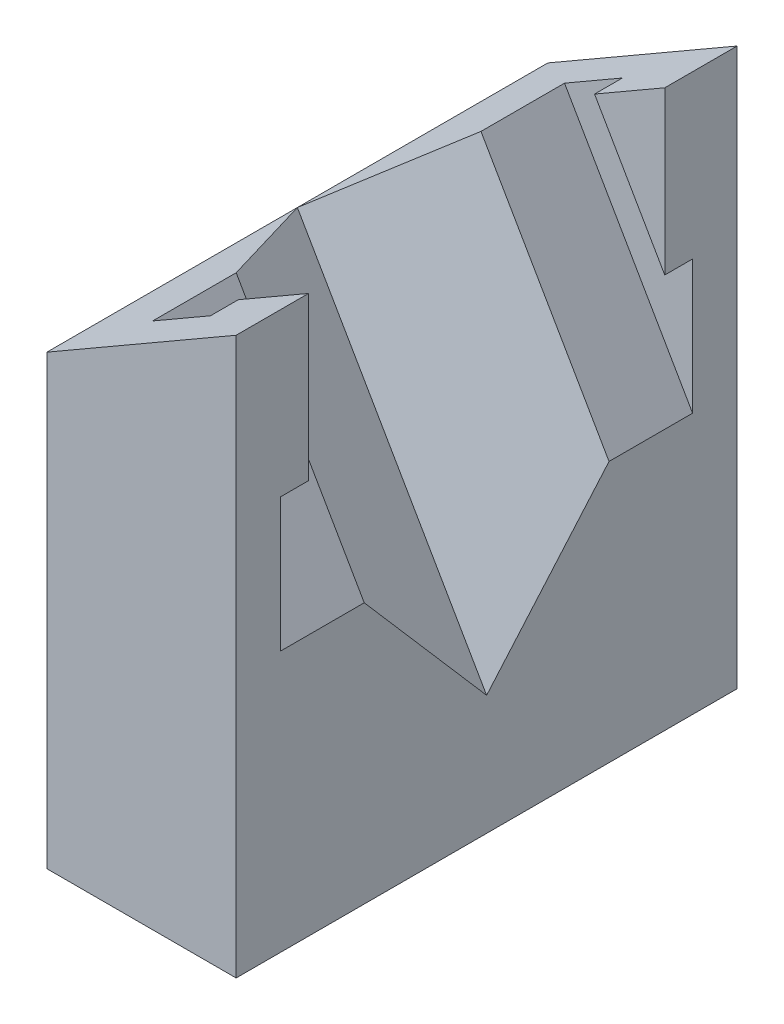
from build123d import *

# Parameters (mm, degrees)
SKETCH1_W           = 17
SKETCH1_H           = 45
BOSS_EXTRUDE1_DEPTH = 50
CUT_EXTRUDE1_DEPTH  = 68.803023531
CUT_EXTRUDE3_DEPTH  = 50.350151975


with BuildPart() as part:
    # Sketch1 → Boss-Extrude1 (new body)
    with BuildSketch(Plane(origin=(0, 0, 0), x_dir=(1, 0, 0), z_dir=(0, 1, 0))):
        Rectangle(SKETCH1_W, SKETCH1_H)
    extrude(amount=BOSS_EXTRUDE1_DEPTH)

    # Sketch2 → Cut-Extrude1 (cut, through all)
    with BuildSketch(Plane.XY.offset(22.5)):
        Polygon((8.5, 50), (-8.5, 40.185045424), (-8.5, 50), align=None)
    extrude(amount=-CUT_EXTRUDE1_DEPTH, mode=Mode.SUBTRACT)

    # Sketch3 → Cut-Extrude3 (cut, through all)
    with BuildSketch(Plane(origin=(-19.525635095, 33.819392034, 0), x_dir=(0.8660254037844417, 0.4999999999999949, 0), z_dir=(-0.4999999999999949, 0.8660254037844417, 0))):
        Polygon((25.078911087, -18.5), (19.078911087, -18.5), (19.078911087, -10.994373166), (12.73130678, 0), (19.078911087, 10.994373166), (19.078911087, 18.5), (25.078911087, 18.5), (25.078911087, 16), (40.444119701, 16), (49.681724008, 0), (40.444119701, -16), (25.078911087, -16), align=None)
    extrude(amount=-CUT_EXTRUDE3_DEPTH, mode=Mode.SUBTRACT)


solid = part.part
